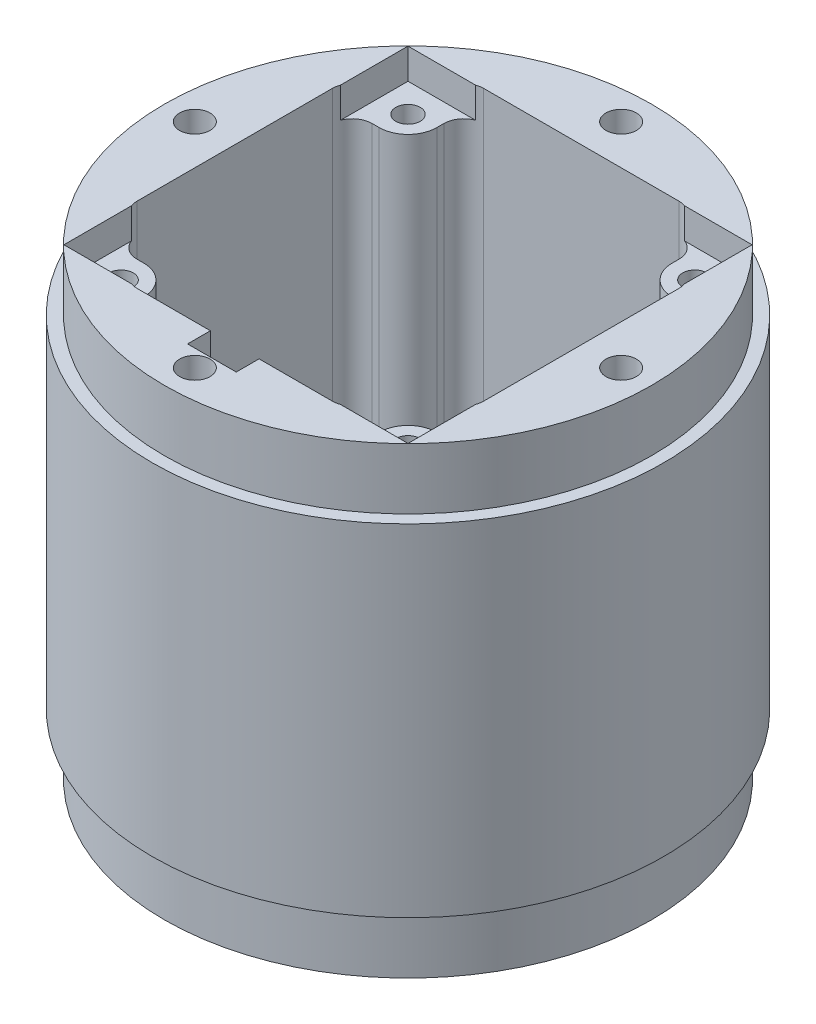
from build123d import *

# Parameters (mm, degrees)
SKETCH2_R           = 40
BOSS_EXTRUDE1_DEPTH = 76
SKETCH3_W           = 8
SKETCH3_H           = 76
CUT_EXTRUDE1_DEPTH  = 4
SKETCH4_R           = 42
SKETCH4_R_2         = 40
BOSS_EXTRUDE3_DEPTH = 28
SKETCH5_W           = 56.5
SKETCH5_H           = 56.5
CUT_EXTRUDE7_DEPTH  = 5
SKETCH6_R           = 2
CUT_EXTRUDE8_DEPTH  = 93.568893263
SKETCH7_R           = 2.5
CUT_EXTRUDE9_DEPTH  = 97.457244414


with BuildPart() as part:
    # Sketch2 → Boss-Extrude1 (new body)
    with BuildSketch(Plane(origin=(0, 0, 0), x_dir=(1, 0, 0), z_dir=(0, 1, 0))):
        with Locations(Location((0, 0, 0), (0, 0, 270))):
            Circle(SKETCH2_R)
        with BuildLine():
            Line((-19.3, 25.2), (-19.3, 24.05))
            ThreePointArc((-19.3, 24.05), (-20.691242789, 20.691242789), (-24.05, 19.3))
            Line((-24.05, 19.3), (-25.2, 19.3))
            ThreePointArc((-25.2, 19.3), (-27.498097039, 18.348097039), (-28.45, 16.05))
            Line((-28.45, 16.05), (-28.45, -16.05))
            ThreePointArc((-28.45, -16.05), (-27.498097039, -18.348097039), (-25.2, -19.3))
            Line((-25.2, -19.3), (-24.05, -19.3))
            ThreePointArc((-24.05, -19.3), (-20.691242789, -20.691242789), (-19.3, -24.05))
            Line((-19.3, -24.05), (-19.3, -25.2))
            ThreePointArc((-19.3, -25.2), (-18.348097039, -27.498097039), (-16.05, -28.45))
            Line((-16.05, -28.45), (16.05, -28.45))
            ThreePointArc((16.05, -28.45), (18.348097039, -27.498097039), (19.3, -25.2))
            Line((19.3, -25.2), (19.3, -24.05))
            ThreePointArc((19.3, -24.05), (20.691242789, -20.691242789), (24.05, -19.3))
            Line((24.05, -19.3), (25.2, -19.3))
            ThreePointArc((25.2, -19.3), (27.498097039, -18.348097039), (28.45, -16.05))
            Line((28.45, -16.05), (28.45, 16.05))
            ThreePointArc((28.45, 16.05), (27.498097039, 18.348097039), (25.2, 19.3))
            Line((25.2, 19.3), (24.05, 19.3))
            ThreePointArc((24.05, 19.3), (20.691242789, 20.691242789), (19.3, 24.05))
            Line((19.3, 24.05), (19.3, 25.2))
            ThreePointArc((19.3, 25.2), (18.348097039, 27.498097039), (16.05, 28.45))
            Line((16.05, 28.45), (-16.05, 28.45))
            ThreePointArc((-16.05, 28.45), (-18.348097039, 27.498097039), (-19.3, 25.2))
        make_face(mode=Mode.SUBTRACT)
    extrude(amount=BOSS_EXTRUDE1_DEPTH)

    # Sketch3 → Cut-Extrude1 (cut)
    with BuildSketch(Plane(origin=(0, 0, 28.2), x_dir=(-1, 0, 0), z_dir=(0, 0, -1))):
        with Locations((0, 38)):
            Rectangle(SKETCH3_W, SKETCH3_H)
    extrude(amount=-CUT_EXTRUDE1_DEPTH, mode=Mode.SUBTRACT)

    # Sketch4 → Boss-Extrude3 (add, symmetric)
    with BuildSketch(Plane(origin=(0, 38, 0), x_dir=(1, 0, 0), z_dir=(0, 1, 0))):
        with Locations(Location((0, 0, 0), (0, 0, 270))):
            Circle(SKETCH4_R)
        with Locations(Location((0, 0, 0), (0, 0, 270))):
            Circle(SKETCH4_R_2, mode=Mode.SUBTRACT)
    extrude(amount=BOSS_EXTRUDE3_DEPTH, both=True)

    # Sketch5 → Cut-Extrude7 (cut)
    with BuildSketch(Plane(origin=(0, 76, 0), x_dir=(1, 0, 0), z_dir=(0, 1, 0))):
        Rectangle(SKETCH5_W, SKETCH5_H)
    extrude(amount=-CUT_EXTRUDE7_DEPTH, mode=Mode.SUBTRACT)

    # Sketch6 → Cut-Extrude8 (cut, through all)
    with BuildSketch(Plane(origin=(0, 71, 0), x_dir=(1, 0, 0), z_dir=(0, 1, 0))):
        with Locations(Location((-23.55, 23.55, 0), (0, 0, 270))):
            Circle(SKETCH6_R)
        with Locations(Location((23.55, 23.55, 0), (0, 0, 270))):
            Circle(SKETCH6_R)
        with Locations(Location((23.55, -23.55, 0), (0, 0, 270))):
            Circle(SKETCH6_R)
        with Locations(Location((-23.55, -23.55, 0), (0, 0, 270))):
            Circle(SKETCH6_R)
    extrude(amount=-CUT_EXTRUDE8_DEPTH, mode=Mode.SUBTRACT)

    # Sketch7 → Cut-Extrude9 (cut, through all)
    with BuildSketch(Plane(origin=(0, 76, 0), x_dir=(1, 0, 0), z_dir=(0, 1, 0))):
        with Locations(Location((0, 35, 0), (0, 0, 270))):
            Circle(SKETCH7_R)
        with Locations(Location((35, 0, 0), (0, 0, 270))):
            Circle(SKETCH7_R)
        with Locations(Location((0, -35, 0), (0, 0, 270))):
            Circle(SKETCH7_R)
        with Locations(Location((-35, 0, 0), (0, 0, 270))):
            Circle(SKETCH7_R)
    extrude(amount=-CUT_EXTRUDE9_DEPTH, mode=Mode.SUBTRACT)


solid = part.part
